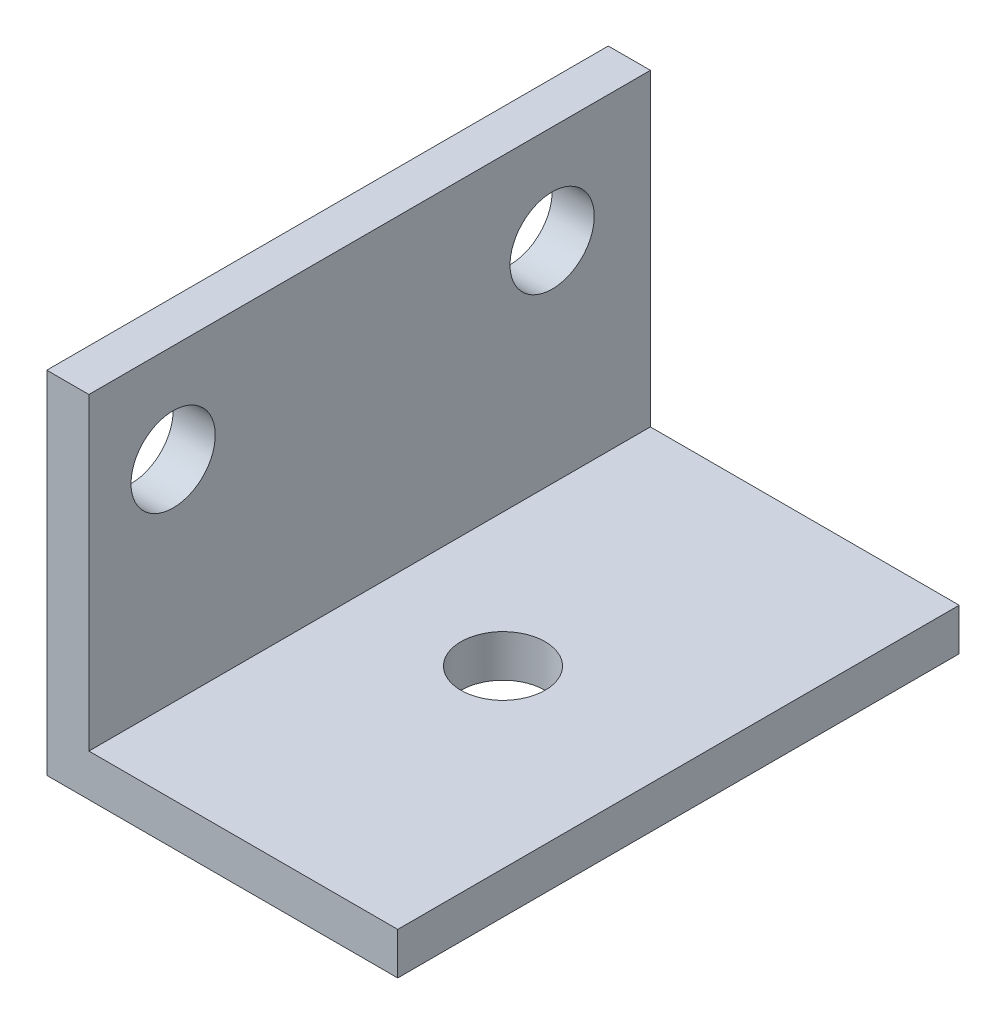
from build123d import *

# Parameters (mm, degrees)
SALIENTE_EXTRUIR1_DEPTH = 20
CROQUIS2_R              = 1.5
CORTAR_EXTRUIR1_DEPTH   = 1.5
CROQUIS3_R              = 1.5
CORTAR_EXTRUIR2_DEPTH   = 1.5


with BuildPart() as part:
    # Croquis1 → Saliente-Extruir1 (new body)
    with BuildSketch(Plane.XY):
        Polygon((0, 0), (12.5, 0), (12.5, 1.5), (1.5, 1.5), (1.5, 12.5), (0, 12.5), align=None)
    extrude(amount=SALIENTE_EXTRUIR1_DEPTH)

    # Croquis2 → Cortar-Extruir1 (cut)
    with BuildSketch(Plane.ZY):
        with Locations(Location((17, 9, 0), (0, 0, 270))):
            Circle(CROQUIS2_R)
        with Locations(Location((3.5, 9, 0), (0, 0, 270))):
            Circle(CROQUIS2_R)
    extrude(amount=-CORTAR_EXTRUIR1_DEPTH, mode=Mode.SUBTRACT)

    # Croquis3 → Cortar-Extruir2 (cut)
    with BuildSketch(Plane.XZ):
        with Locations(Location((6.25, 10, 0), (0, 0, 270))):
            Circle(CROQUIS3_R)
    extrude(amount=-CORTAR_EXTRUIR2_DEPTH, mode=Mode.SUBTRACT)


solid = part.part
